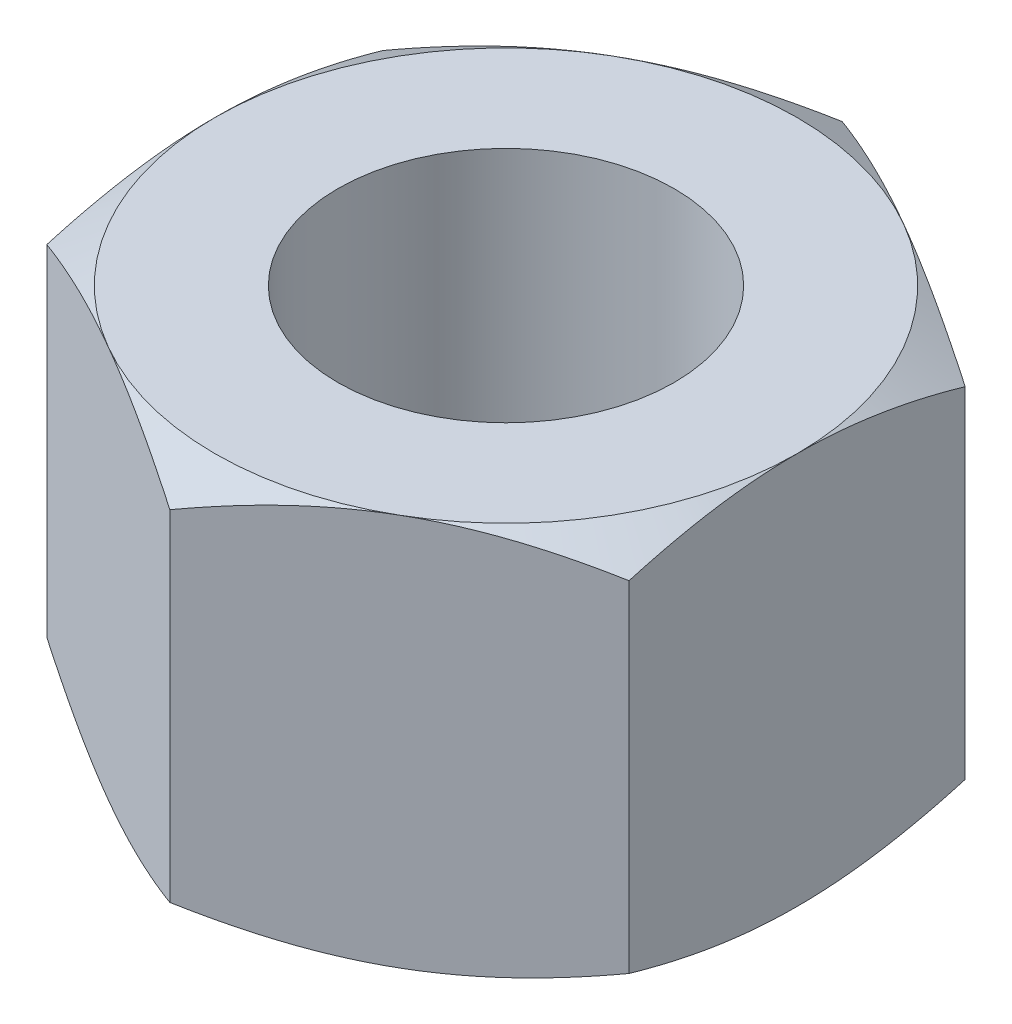
from build123d import *

# Parameters (mm, degrees)
SKETCH1_R                    = 15
BOSS_EXTRUDE1_DEPTH          = 17.5
SKETCH2_OUTSIDE_W            = 192.554
SKETCH2_OUTSIDE_H            = 200.592
SKETCH2_OUTSIDE_R            = 25.980762114
CUT_EXTRUDE1_DEPTH           = 17.5
CUT_EXTRUDE1_TAPER           = 60
CUT_EXTRUDE1_OTHER_WAY_DEPTH = 17.5
CUT_EXTRUDE1_OTHER_WAY_DRAFT = -60
MIRROR1_COPY_1_SKETCH_W      = 192.554
MIRROR1_COPY_1_SKETCH_H      = 200.592
MIRROR1_COPY_1_SKETCH_R      = 25.980762114
MIRROR1_COPY_1_DEPTH         = 17.5
MIRROR1_COPY_1_DRAFT         = -60
MIRROR1_COPY_2_SKETCH_W      = 192.554
MIRROR1_COPY_2_SKETCH_H      = 200.592
MIRROR1_COPY_2_SKETCH_R      = 25.980762114
MIRROR1_COPY_2_DEPTH         = 17.5
MIRROR1_COPY_2_DRAFT         = -60


with BuildPart() as part:
    # Sketch1 → Boss-Extrude1 (new, symmetric)
    with BuildSketch(Plane(origin=(0, 0, 0), x_dir=(1, 0, 0), z_dir=(0, 1, 0))):
        Polygon((0, 30), (-25.980762114, 15), (-25.980762114, -15), (0, -30), (25.980762114, -15), (25.980762114, 15), align=None)
        with Locations(Location((0, 0, 0), (0, 0, 270))):
            Circle(SKETCH1_R, mode=Mode.SUBTRACT)
    extrude(amount=BOSS_EXTRUDE1_DEPTH, both=True)

    # Sketch2 outside → Cut-Extrude1 (cut)
    with BuildSketch(Plane(origin=(0, 17.5, 0), x_dir=(1, 0, 0), z_dir=(0, 1, 0))):
        Rectangle(SKETCH2_OUTSIDE_W, SKETCH2_OUTSIDE_H)
        Circle(SKETCH2_OUTSIDE_R, mode=Mode.SUBTRACT)
    cut_extrude1 = extrude(amount=CUT_EXTRUDE1_DEPTH, taper=CUT_EXTRUDE1_TAPER, mode=Mode.SUBTRACT)


with BuildPart() as cut_extrude1_other_way_tool:
    # Sketch2 outside → Cut-Extrude1 other way (with draft: the straight prism first)
    with BuildSketch(Plane(origin=(0, 17.5, 0), x_dir=(1, 0, 0), z_dir=(0, 1, 0))):
        Rectangle(SKETCH2_OUTSIDE_W, SKETCH2_OUTSIDE_H)
        Circle(SKETCH2_OUTSIDE_R, mode=Mode.SUBTRACT)
    extrude(amount=-CUT_EXTRUDE1_OTHER_WAY_DEPTH)
    # Cut-Extrude1 other way: the draft: its side faces are tilted about the plane it starts from
    cut_extrude1_other_way_sides = [cut_extrude1_other_way_tool.faces().sort_by_distance(p)[0] for p in [
        (0, 8.75, 100.296),
        (96.277, 8.75, 0),
        (0, 8.75, -100.296),
        (-96.277, 8.75, 0),
        (-25.980762114, 8.75, 0),
    ]]
    draft(cut_extrude1_other_way_sides, Plane(origin=(0, 17.5, 0), x_dir=(1, 0, 0), z_dir=(0, 1, 0)), CUT_EXTRUDE1_OTHER_WAY_DRAFT)


with BuildPart() as part_1:
    add(part.part)

    # Cut-Extrude1 other way: cut by cut_extrude1_other_way_tool
    add(cut_extrude1_other_way_tool.part, mode=Mode.SUBTRACT)

    # Mirror1: Cut-Extrude1 across plane
    add(cut_extrude1.mirror(Plane.ZX), mode=Mode.SUBTRACT)


with BuildPart() as mirror1_copy_1_tool:
    # Mirror1 copy 1 sketch → Mirror1 copy 1 (with draft: the straight prism first)
    with BuildSketch(Plane.XZ.offset(17.5)):
        Rectangle(MIRROR1_COPY_1_SKETCH_W, MIRROR1_COPY_1_SKETCH_H)
        Circle(MIRROR1_COPY_1_SKETCH_R, mode=Mode.SUBTRACT)
    extrude(amount=-MIRROR1_COPY_1_DEPTH)
    # Mirror1 copy 1: the draft: its side faces are tilted about the plane it starts from
    mirror1_copy_1_sides = [mirror1_copy_1_tool.faces().sort_by_distance(p)[0] for p in [
        (0, -8.75, 100.296),
        (96.277, -8.75, 0),
        (0, -8.75, -100.296),
        (-96.277, -8.75, 0),
        (-25.980762114, -8.75, 0),
    ]]
    draft(mirror1_copy_1_sides, Plane.XZ.offset(17.5), MIRROR1_COPY_1_DRAFT)


with BuildPart() as part_2:
    add(part_1.part)

    # Mirror1 copy 1: cut by mirror1_copy_1_tool
    add(mirror1_copy_1_tool.part, mode=Mode.SUBTRACT)


with BuildPart() as mirror1_copy_2_tool:
    # Mirror1 copy 2 sketch → Mirror1 copy 2 (with draft: the straight prism first)
    with BuildSketch(Plane.XZ.offset(17.5)):
        Rectangle(MIRROR1_COPY_2_SKETCH_W, MIRROR1_COPY_2_SKETCH_H)
        Circle(MIRROR1_COPY_2_SKETCH_R, mode=Mode.SUBTRACT)
    extrude(amount=-MIRROR1_COPY_2_DEPTH)
    # Mirror1 copy 2: the draft: its side faces are tilted about the plane it starts from
    mirror1_copy_2_sides = [mirror1_copy_2_tool.faces().sort_by_distance(p)[0] for p in [
        (0, -8.75, 100.296),
        (96.277, -8.75, 0),
        (0, -8.75, -100.296),
        (-96.277, -8.75, 0),
        (-25.980762114, -8.75, 0),
    ]]
    draft(mirror1_copy_2_sides, Plane.XZ.offset(17.5), MIRROR1_COPY_2_DRAFT)


with BuildPart() as part_3:
    add(part_2.part)

    # Mirror1 copy 2: cut by mirror1_copy_2_tool
    add(mirror1_copy_2_tool.part, mode=Mode.SUBTRACT)


solid = part_3.part
